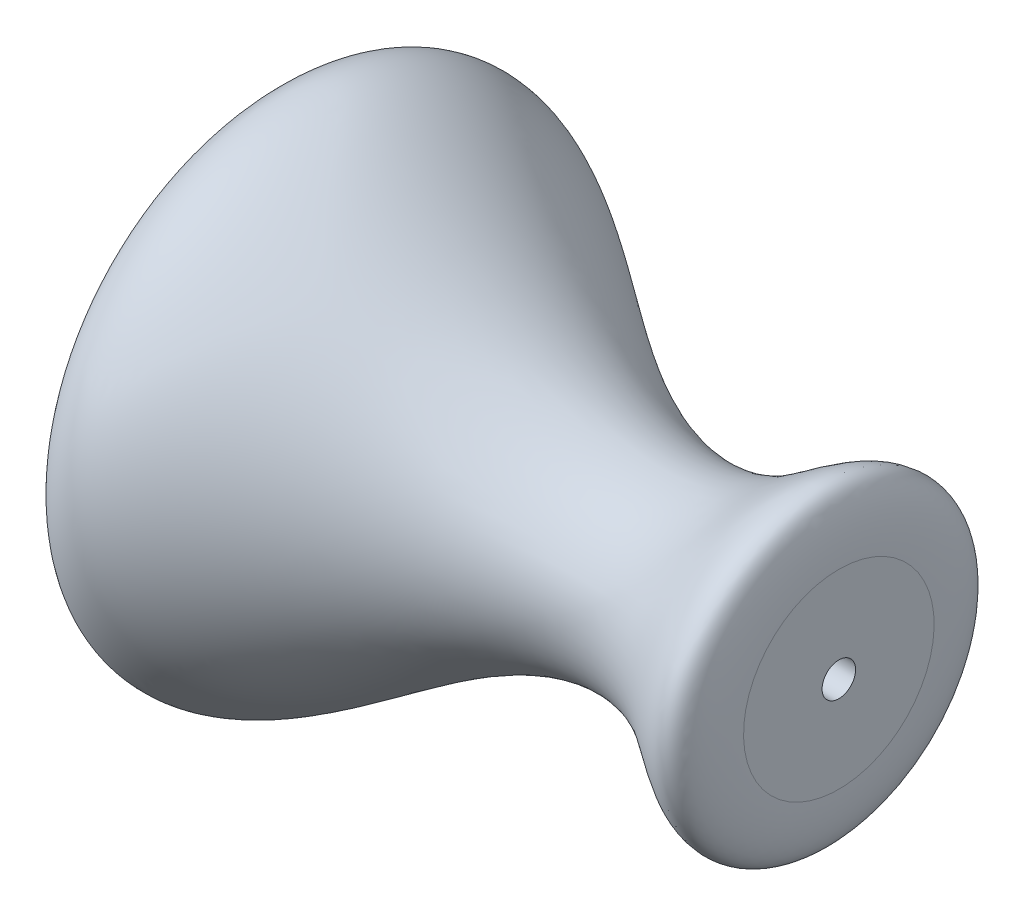
from build123d import *


with BuildPart() as part:
    # Esquisse1 → Révolution1 (revolve)
    with BuildSketch(Plane.XY):
        with BuildLine():
            Line((115.724163653, 17.817721799), (115.724163653, 3.136452901))
            Line((115.724163653, 3.136452901), (56.999088062, 3.136452901))
            Line((56.999088062, 3.136452901), (53.862635161, 0))
            Line((53.862635161, 0), (0, 0))
            add(Edge.make_bspline(
                [(0, 0), (6.482311818, 79.358757341), (40.439449664, 24.547674208), (95.704936422, 12.933668756), (115.607304115, 37.682549015), (115.724163653, 17.817721799)],
                knots=[0, 0, 0, 0, 0.608951516, 0.823188353, 1, 1, 1, 1], degree=3))
        make_face()
    revolve(axis=Axis((53.862635161, 0, 0), (-1, 0, 0)))


solid = part.part
